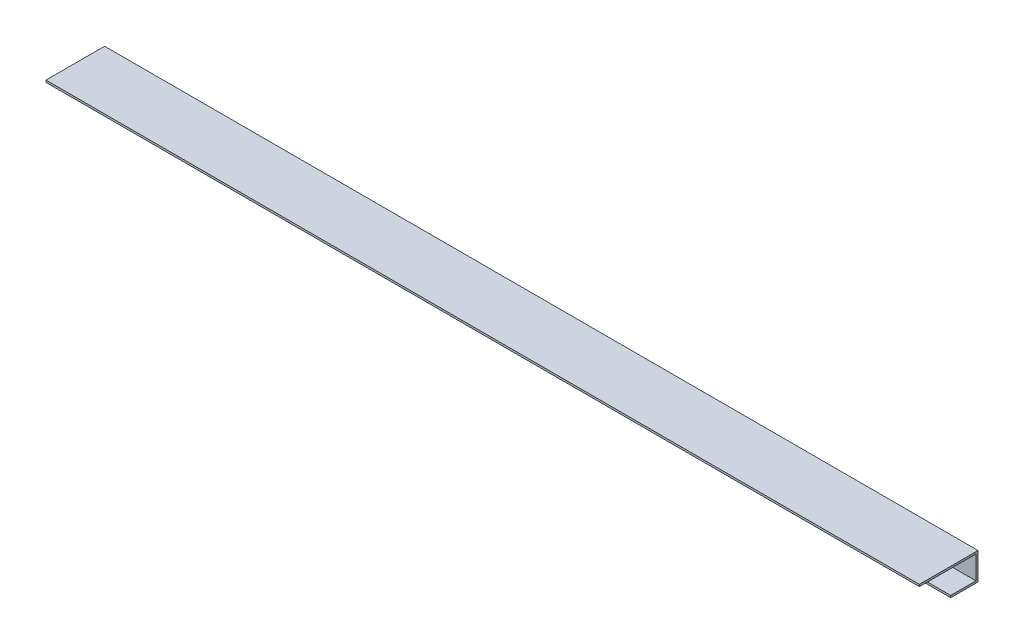
from build123d import *

# Parameters (mm, degrees)
BOSS_EXTRUDE1_DEPTH = 864


with BuildPart() as part:
    # Sketch1 → Boss-Extrude1 (new body)
    with BuildSketch(Plane(origin=(0, 0, 0), x_dir=(0, 0, -1), z_dir=(1, 0, 0))):
        Polygon((0, 0), (58, 0), (58, -27), (31, -27), (31, -25), (56, -25), (56, -2), (0, -2), align=None)
    extrude(amount=BOSS_EXTRUDE1_DEPTH)


solid = part.part
